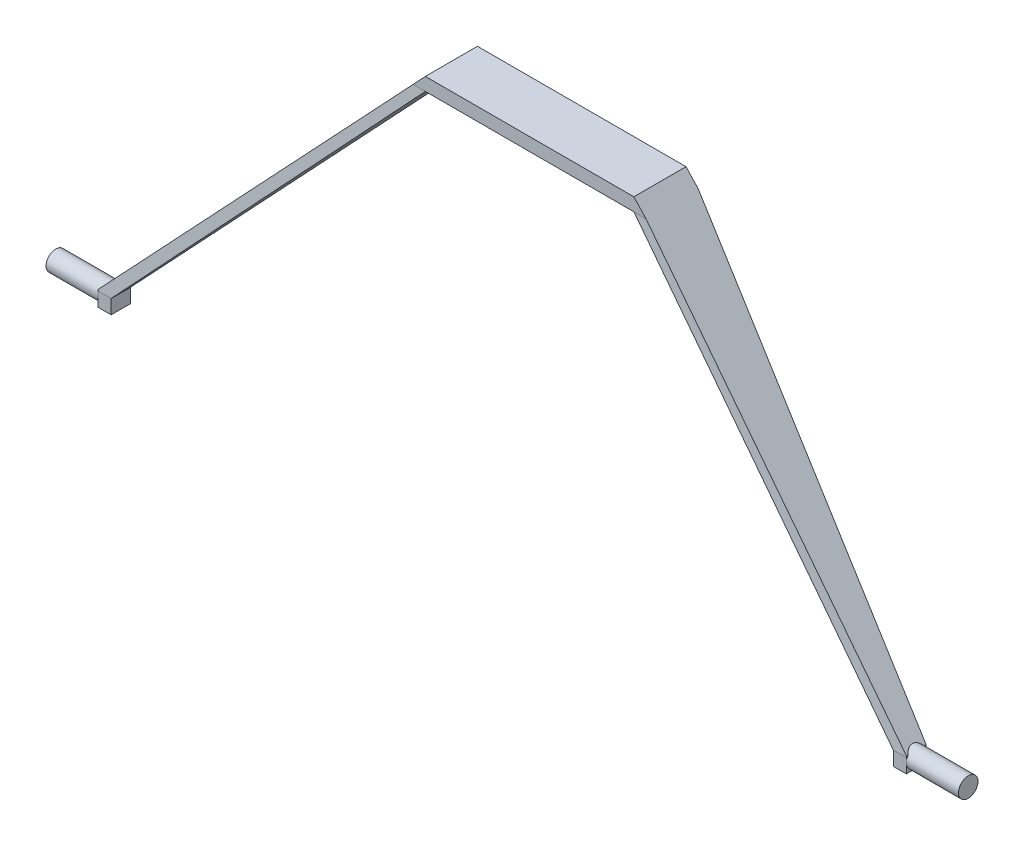
from build123d import *

# Parameters (mm, degrees)
BOSS_EXTRUDE6_DEPTH            = 53.34
BOSS_EXTRUDE6_DEPTH_BACK       = 101.6
CUT_EXTRUDE8_REACH             = 902.262
CUT_EXTRUDE8_DIRECTION_2_REACH = 902.262
SKETCH15_R                     = 19.05
BOSS_EXTRUDE8_DEPTH            = 127
CUT_EXTRUDE9_REACH             = 1709.816
SKETCH16_W                     = 38.1
SKETCH16_H                     = 10.414
CUT_EXTRUDE9_DIRECTION_2_REACH = 1709.816


with BuildPart() as part:
    # Sketch12 → Boss-Extrude6 (new, two sides: drawn at the far end of the back side and taken through both)
    with BuildSketch(Plane.XY.offset(-BOSS_EXTRUDE6_DEPTH_BACK)):
        Polygon((-203.2, 241.3), (203.2, 241.3), (787.471663752, -383.669201703), (787.471663752, -424.309201703), (762.071663752, -424.309201703), (762.071663752, -386.209201703), (203.2, 215.9), (-203.2, 215.9), (-762.071663752, -386.209201703), (-762.071663752, -424.309201703), (-787.471663752, -424.309201703), (-787.471663752, -383.669201703), align=None)
    extrude(amount=BOSS_EXTRUDE6_DEPTH + BOSS_EXTRUDE6_DEPTH_BACK)

    # Cut-Extrude8: up to this plane
    cut_extrude8_end = Plane(origin=(-203.2, 241.3, -101.6), z_dir=(-0.7304911811601322, 0.6829221289775833, 0))
    # Sketch14 → Cut-Extrude8 (cut, up to the surface)
    with BuildSketch(Plane(origin=(0, 0, 0), x_dir=(0, 0, -1), z_dir=(1, 0, 0)), mode=Mode.PRIVATE) as cut_extrude8_sk1:
        Polygon((0, 241.3), (0, 215.9), (-53.34, -386.209201703), (-53.34, 241.3), align=None)
    cut_extrude8_tool1 = split(extrude(cut_extrude8_sk1.sketch, amount=-CUT_EXTRUDE8_REACH, mode=Mode.PRIVATE), bisect_by=cut_extrude8_end, keep=Keep.BOTH, mode=Mode.PRIVATE)
    add(cut_extrude8_tool1.solids().sort_by_distance((0, 31.800889, 34.868308))[0], mode=Mode.SUBTRACT)
    # Sketch14 → Cut-Extrude8 (cut, up to the surface)
    with BuildSketch(Plane(origin=(0, 0, 0), x_dir=(0, 0, -1), z_dir=(1, 0, 0)), mode=Mode.PRIVATE) as cut_extrude8_sk2:
        Polygon((101.6, 215.9), (-15.24, -386.209201703), (-15.24, -424.309201703), (101.6, -424.309201703), align=None)
    cut_extrude8_tool2 = split(extrude(cut_extrude8_sk2.sketch, amount=-CUT_EXTRUDE8_REACH, mode=Mode.PRIVATE), bisect_by=cut_extrude8_end, keep=Keep.BOTH, mode=Mode.PRIVATE)
    add(cut_extrude8_tool2.solids().sort_by_distance((0, -210.192787, -60.465735))[0], mode=Mode.SUBTRACT)

    # Cut-Extrude8 direction 2: up to this plane
    cut_extrude8_direction_2_end = Plane(origin=(203.2, 241.3, -101.6), z_dir=(0.7304911811601321, 0.6829221289775835, 0))
    # Sketch14 → Cut-Extrude8 direction 2 (cut, up to the surface)
    with BuildSketch(Plane(origin=(0, 0, 0), x_dir=(0, 0, -1), z_dir=(1, 0, 0)), mode=Mode.PRIVATE) as cut_extrude8_direction_2_sk1:
        Polygon((0, 241.3), (0, 215.9), (-53.34, -386.209201703), (-53.34, 241.3), align=None)
    cut_extrude8_direction_2_tool1 = split(extrude(cut_extrude8_direction_2_sk1.sketch, amount=CUT_EXTRUDE8_DIRECTION_2_REACH, mode=Mode.PRIVATE), bisect_by=cut_extrude8_direction_2_end, keep=Keep.BOTH, mode=Mode.PRIVATE)
    add(cut_extrude8_direction_2_tool1.solids().sort_by_distance((0, 31.800889, 34.868308))[0], mode=Mode.SUBTRACT)
    # Sketch14 → Cut-Extrude8 direction 2 (cut, up to the surface)
    with BuildSketch(Plane(origin=(0, 0, 0), x_dir=(0, 0, -1), z_dir=(1, 0, 0)), mode=Mode.PRIVATE) as cut_extrude8_direction_2_sk2:
        Polygon((101.6, 215.9), (-15.24, -386.209201703), (-15.24, -424.309201703), (101.6, -424.309201703), align=None)
    cut_extrude8_direction_2_tool2 = split(extrude(cut_extrude8_direction_2_sk2.sketch, amount=CUT_EXTRUDE8_DIRECTION_2_REACH, mode=Mode.PRIVATE), bisect_by=cut_extrude8_direction_2_end, keep=Keep.BOTH, mode=Mode.PRIVATE)
    add(cut_extrude8_direction_2_tool2.solids().sort_by_distance((0, -210.192787, -60.465735))[0], mode=Mode.SUBTRACT)

    # Sketch15 → Boss-Extrude8 (add)
    with BuildSketch(Plane.ZY.offset(762.071663752)):
        with Locations((34.29, -394.845201703)):
            Circle(SKETCH15_R)
    boss_extrude8 = extrude(amount=BOSS_EXTRUDE8_DEPTH)

    # Mirror2: Boss-Extrude8 across plane
    add(boss_extrude8.mirror(Plane(origin=(0, 0, 0), x_dir=(0, 0, 1), z_dir=(1, 0, 0))))

    # Cut-Extrude9: up to this face of the body (flat: up to its plane)
    cut_extrude9_end = Plane(part.part.faces().sort_by_distance((-787.471663752, -416.434815963, 34.29))[0])
    # Sketch16 → Cut-Extrude9 (cut, up to the picked face)
    with BuildSketch(Plane.ZY.offset(762.071663752), mode=Mode.PRIVATE) as cut_extrude9_sk1:
        with Locations((34.29, -419.102201703)):
            Rectangle(SKETCH16_W, SKETCH16_H)
    cut_extrude9_tool1 = split(extrude(cut_extrude9_sk1.sketch, amount=CUT_EXTRUDE9_REACH, mode=Mode.PRIVATE), bisect_by=cut_extrude9_end, keep=Keep.BOTH, mode=Mode.PRIVATE)
    add(cut_extrude9_tool1.solids().sort_by(Axis((-762.071664, -419.102202, 34.29), (-1, 0, 0)))[0], mode=Mode.SUBTRACT)

    # Cut-Extrude9 direction 2: up to this face of the body (flat: up to its plane)
    cut_extrude9_direction_2_end = Plane(part.part.faces().sort_by_distance((787.471663752, -416.434815963, 34.29))[0])
    # Sketch16 → Cut-Extrude9 direction 2 (cut, up to the picked face)
    with BuildSketch(Plane.ZY.offset(762.071663752), mode=Mode.PRIVATE) as cut_extrude9_direction_2_sk1:
        with Locations((34.29, -419.102201703)):
            Rectangle(SKETCH16_W, SKETCH16_H)
    cut_extrude9_direction_2_tool1 = split(extrude(cut_extrude9_direction_2_sk1.sketch, amount=-CUT_EXTRUDE9_DIRECTION_2_REACH, mode=Mode.PRIVATE), bisect_by=cut_extrude9_direction_2_end, keep=Keep.BOTH, mode=Mode.PRIVATE)
    add(cut_extrude9_direction_2_tool1.solids().sort_by(Axis((-762.071664, -419.102202, 34.29), (1, 0, 0)))[0], mode=Mode.SUBTRACT)


solid = part.part
